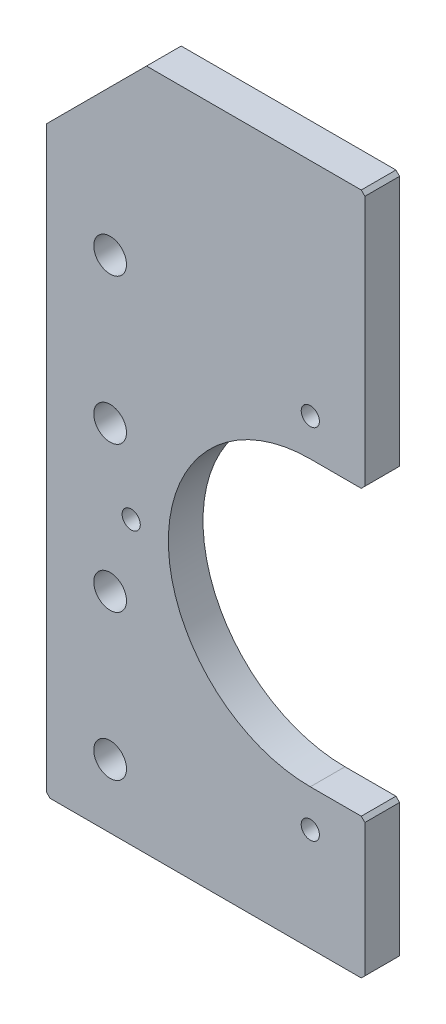
from build123d import *

# Parameters (mm, degrees)
BOSS_EXTRUDE1_DEPTH   = 4.7625
M8_CLEARANCE_HOLE1_D  = 9
M6X1_0_TAPPED_HOLE1_D = 5
CHAMFER1_SIZE         = 1


with BuildPart() as part:
    # Sketch1 → Boss-Extrude1 (new, symmetric)
    with BuildSketch(Plane.XY):
        with BuildLine():
            Line((0, -39), (15, -39))
            Line((15, -39), (15, -77.5))
            Line((15, -77.5), (-72.5, -77.5))
            Line((-72.5, -77.5), (-72.5, 82.5))
            Line((-72.5, 82.5), (-45, 110))
            Line((-45, 110), (15, 110))
            Line((15, 110), (15, 39))
            Line((15, 39), (0, 39))
            ThreePointArc((0, 39), (-39, 0), (0, -39))
        make_face()
    extrude(amount=BOSS_EXTRUDE1_DEPTH, both=True)

    # M8 Clearance Hole1 (through all)
    with Locations(Plane.XY.offset(4.7625)):
        with Locations((-55, 60), (-55, 20), (-55, -20), (-55, -60)):
            Hole(M8_CLEARANCE_HOLE1_D / 2)

    # M6x1.0 Tapped Hole1 (through all)
    with Locations(Plane.XY.offset(4.7625)):
        with Locations((0, 49.2125), (-49.2125, 0), (0, -49.2125)):
            Hole(M6X1_0_TAPPED_HOLE1_D / 2)

    # Chamfer1
    chamfer1_edges = [part.edges().sort_by_distance(p)[0] for p in [
        (15, -39, 0),
        (15, -77.5, 0),
        (-72.5, -77.5, 0),
        (15, 110, 0),
        (15, 39, 0),
    ]]
    chamfer(chamfer1_edges, length=CHAMFER1_SIZE)


solid = part.part
